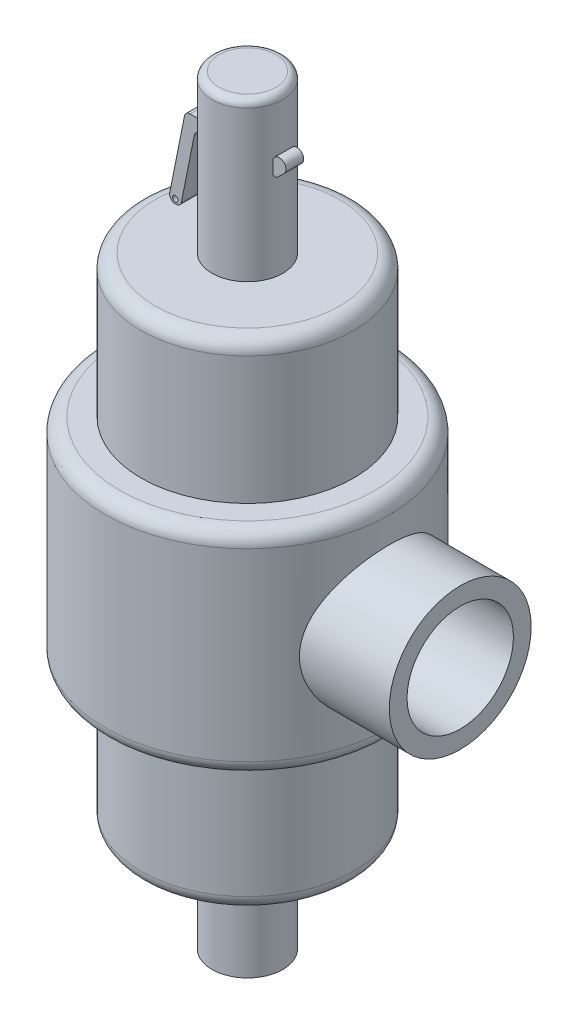
from build123d import *

# Parameters (mm, degrees)
SKETCH1_R                = 6.35
BOSS_EXTRUDE1_DEPTH      = 19.05
SKETCH2_R                = 19.05
BOSS_EXTRUDE2_DEPTH      = 25.4
SKETCH3_R                = 25.4
BOSS_EXTRUDE3_DEPTH      = 38.1
SKETCH4_R                = 19.05
BOSS_EXTRUDE4_DEPTH      = 25.4
SKETCH6_R                = 6.35
BOSS_EXTRUDE5_DEPTH      = 28.194
SKETCH8_R                = 12.7
SKETCH8_R_2              = 9.525
BOSS_EXTRUDE7_DEPTH      = 38.1
BOSS_EXTRUDE8_DEPTH      = 1.5875
BOSS_EXTRUDE8_DEPTH_BACK = 1.5875
FILLET1_R                = 2.54
FILLET3_R                = 1.27
CUT_EXTRUDE1_REACH       = 145.927
SKETCH10_R               = 0.492787201


with BuildPart() as part:
    # Sketch1 → Boss-Extrude1 (new body)
    with BuildSketch(Plane(origin=(0, 0, 0), x_dir=(1, 0, 0), z_dir=(0, 1, 0))):
        Circle(SKETCH1_R)
    extrude(amount=BOSS_EXTRUDE1_DEPTH)

    # Sketch2 → Boss-Extrude2 (add)
    with BuildSketch(Plane(origin=(0, 19.05, 0), x_dir=(1, 0, 0), z_dir=(0, 1, 0))):
        Circle(SKETCH2_R)
    extrude(amount=BOSS_EXTRUDE2_DEPTH)

    # Sketch3 → Boss-Extrude3 (add)
    with BuildSketch(Plane(origin=(0, 44.45, 0), x_dir=(1, 0, 0), z_dir=(0, 1, 0))):
        Circle(SKETCH3_R)
    extrude(amount=BOSS_EXTRUDE3_DEPTH)

    # Sketch4 → Boss-Extrude4 (add)
    with BuildSketch(Plane(origin=(0, 82.55, 0), x_dir=(1, 0, 0), z_dir=(0, 1, 0))):
        Circle(SKETCH4_R)
    extrude(amount=BOSS_EXTRUDE4_DEPTH)

    # Sketch6 → Boss-Extrude5 (add)
    with BuildSketch(Plane(origin=(0, 107.95, 0), x_dir=(1, 0, 0), z_dir=(0, 1, 0))):
        Circle(SKETCH6_R)
    extrude(amount=BOSS_EXTRUDE5_DEPTH)

    # Sketch8 → Boss-Extrude7 (add)
    with BuildSketch(Plane(origin=(0, 0, 0), x_dir=(0, 0, -1), z_dir=(1, 0, 0))):
        with Locations((0, 62.6872)):
            Circle(SKETCH8_R)
        with Locations((0, 62.6872)):
            Circle(SKETCH8_R_2, mode=Mode.SUBTRACT)
    extrude(amount=BOSS_EXTRUDE7_DEPTH)

    # Sketch9 → Boss-Extrude8 (add, two sides: drawn at the far end of the back side and taken through both)
    with BuildSketch(Plane.XY.offset(-BOSS_EXTRUDE8_DEPTH_BACK)):
        with BuildLine():
            Line((8.114515419, 125.073963283), (6.806070155, 123.814961738))
            Line((6.806070155, 123.814961738), (-6.937623928, 123.814961738))
            ThreePointArc((-6.937623928, 123.814961738), (-7.582023221, 123.584458747), (-7.934028883, 122.997539593))
            Line((-7.934028883, 122.997539593), (-10.230756182, 111.473241157))
            ThreePointArc((-10.230756182, 111.473241157), (-10.582761844, 110.886322003), (-11.227161138, 110.655819012))
            Line((-11.227161138, 110.655819012), (-11.332644522, 110.655819012))
            ThreePointArc((-11.332644522, 110.655819012), (-12.11814153, 111.027419718), (-12.329049477, 111.870396866))
            Line((-12.329049477, 111.870396866), (-9.688493735, 125.119924761))
            ThreePointArc((-9.688493735, 125.119924761), (-9.336488073, 125.706843914), (-8.692088779, 125.937346906))
            Line((-8.692088779, 125.937346906), (6.085596345, 125.937346906))
            ThreePointArc((6.085596345, 125.937346906), (7.752909986, 127.03983771), (8.114515419, 125.073963283))
        make_face()
    extrude(amount=BOSS_EXTRUDE8_DEPTH + BOSS_EXTRUDE8_DEPTH_BACK)

    # Fillet1
    fillet1_edges = [part.edges().sort_by_distance(p)[0] for p in [
        (-19.05, 19.05, 0),
        (-25.4, 44.45, 0),
        (-25.4, 82.55, 0),
        (-19.05, 107.95, 0),
    ]]
    fillet(fillet1_edges, radius=FILLET1_R)

    # Fillet3
    fillet3_edges = [part.edges().sort_by_distance(p)[0] for p in [
        (-6.35, 136.144, 0),
    ]]
    fillet(fillet3_edges, radius=FILLET3_R)

    # Sketch10 → Cut-Extrude1 (cut, up to next)
    with BuildSketch(Plane.XY.offset(1.5875), mode=Mode.PRIVATE) as cut_extrude1_sk1:
        with Locations((-11.315111441, 111.468988839)):
            Circle(SKETCH10_R)
    cut_extrude1_tool1 = extrude(cut_extrude1_sk1.sketch, amount=-CUT_EXTRUDE1_REACH, mode=Mode.PRIVATE) & part.part
    add(cut_extrude1_tool1.solids().sort_by_distance((-11.315111, 111.468989, 1.5875))[0], mode=Mode.SUBTRACT)


solid = part.part
